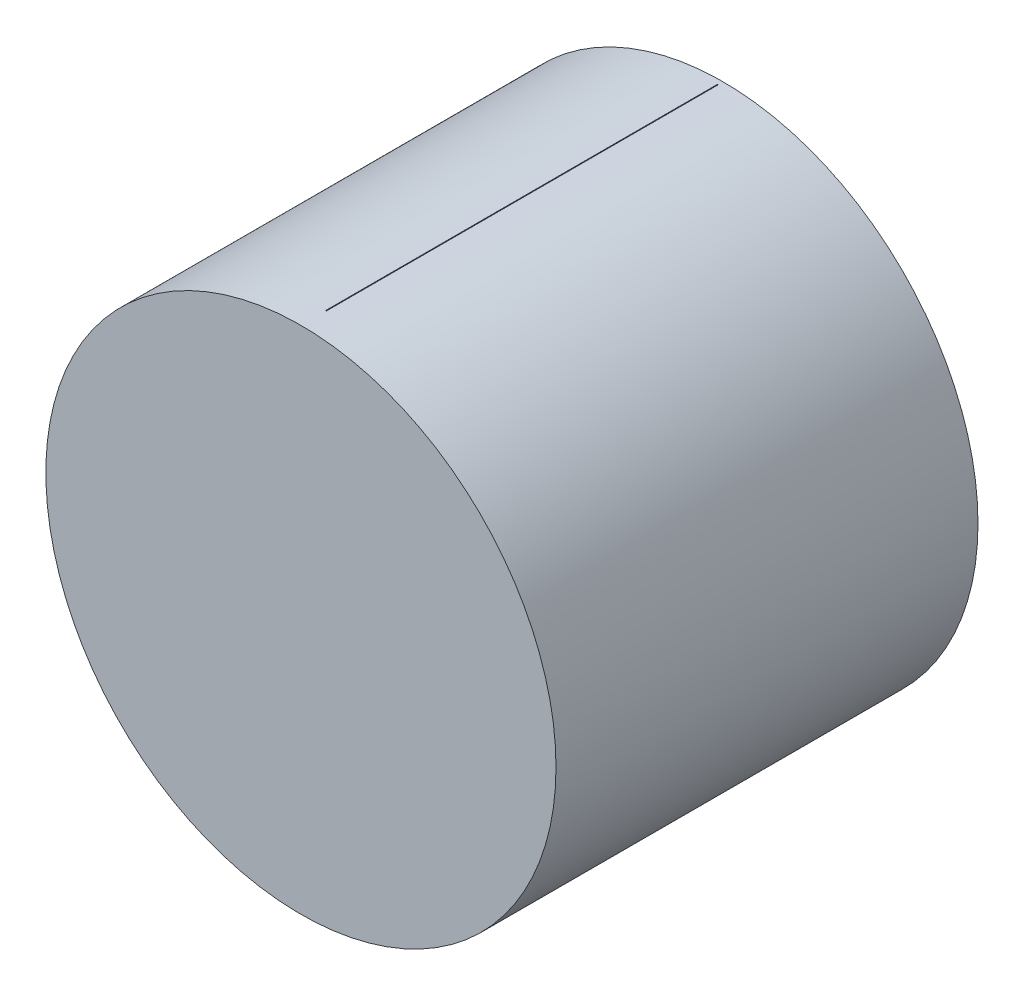
from build123d import *

# Parameters (mm, degrees)
SKETCH_1_R          = 14.925
EXTRUDE_1_DEPTH     = 2
EXTRUDE_START       = -28
SKETCH_2_R          = 16.925
SKETCH_2_R_2        = 14.925
EXTRUDE_2_DEPTH     = 28
SKETCH_3_W          = 0.05
SKETCH_3_H          = 26
CUT_EXTRUDE_1_DEPTH = 27


with BuildPart() as part:
    # Эскиз1 → Бобышка-Вытянуть1 (new body)
    with BuildSketch(Plane.XY):
        Circle(SKETCH_1_R)
    extrude(amount=EXTRUDE_1_DEPTH)

    # Эскиз2 → Бобышка-Вытянуть2 (add)
    with BuildSketch(Plane.XY.offset(2).offset(EXTRUDE_START)):
        Circle(SKETCH_2_R)
        Circle(SKETCH_2_R_2, mode=Mode.SUBTRACT)
    extrude(amount=EXTRUDE_2_DEPTH)

    # Эскиз3 → Вырез-Вытянуть1 (cut)
    with BuildSketch(Plane(origin=(-4.399906999, 4.240400233, -22), x_dir=(1, 0, 0), z_dir=(0, 1, 0))):
        with Locations((4.39587448, -9.32957199)):
            Rectangle(SKETCH_3_W, SKETCH_3_H)
    extrude(amount=CUT_EXTRUDE_1_DEPTH, mode=Mode.SUBTRACT)


solid = part.part
